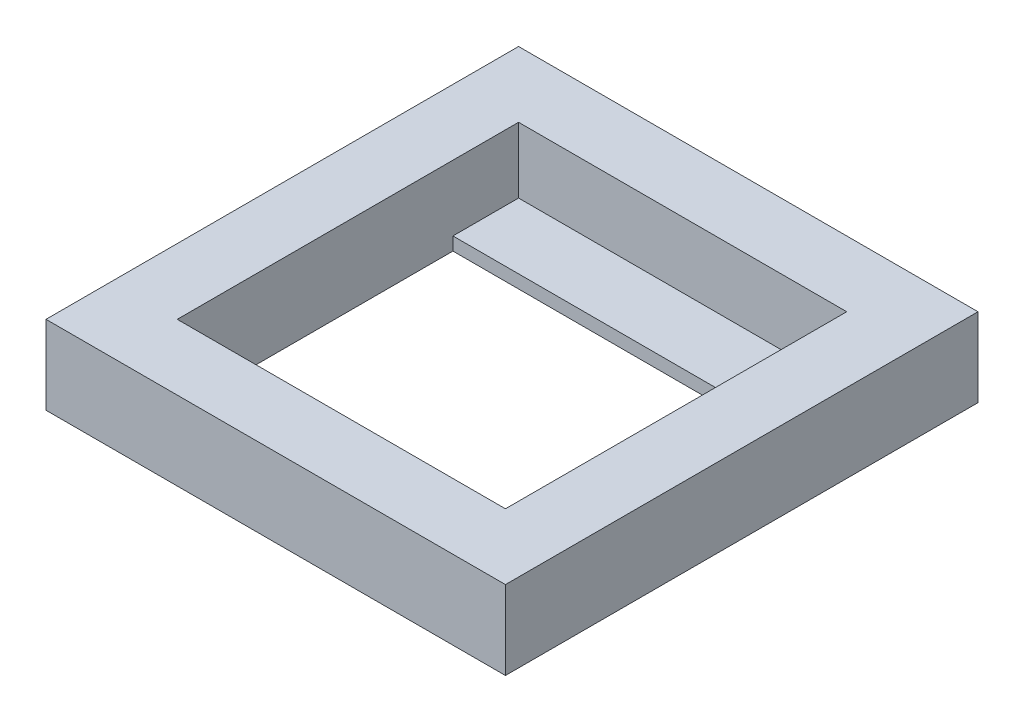
from build123d import *

# Parameters (mm, degrees)
SKETCH1_W           = 70
SKETCH1_H           = 72
BOSS_EXTRUDE1_DEPTH = 2
SKETCH2_W           = 50
SKETCH2_H           = 32
CUT_EXTRUDE1_DEPTH  = 12
SKETCH3_W           = 10
SKETCH3_H           = 52
SKETCH3_H_2         = 10
SKETCH3_W_2         = 50
BOSS_EXTRUDE2_DEPTH = 10


with BuildPart() as part:
    # Sketch1 → Boss-Extrude1 (new body)
    with BuildSketch(Plane(origin=(0, 0, 0), x_dir=(1, 0, 0), z_dir=(0, 1, 0))):
        with Locations((35, 36)):
            Rectangle(SKETCH1_W, SKETCH1_H)
    extrude(amount=BOSS_EXTRUDE1_DEPTH)

    # Sketch2 → Cut-Extrude1 (cut)
    with BuildSketch(Plane(origin=(0, 2, 0), x_dir=(1, 0, 0), z_dir=(0, 1, 0))):
        with Locations((35, 36)):
            Rectangle(SKETCH2_W, SKETCH2_H)
    extrude(amount=-CUT_EXTRUDE1_DEPTH, mode=Mode.SUBTRACT)

    # Sketch3 → Boss-Extrude2 (add)
    with BuildSketch(Plane(origin=(0, 2, 0), x_dir=(1, 0, 0), z_dir=(0, 1, 0))):
        with Locations((5, 36)):
            Rectangle(SKETCH3_W, SKETCH3_H)
        with Locations((5, 67)):
            Rectangle(SKETCH3_W, SKETCH3_H_2)
        with Locations((35, 67)):
            Rectangle(SKETCH3_W_2, SKETCH3_H_2)
        with Locations((5, 5)):
            Rectangle(SKETCH3_W, SKETCH3_H_2)
        with Locations((35, 5)):
            Rectangle(SKETCH3_W_2, SKETCH3_H_2)
        with Locations((65, 5)):
            Rectangle(SKETCH3_W, SKETCH3_H_2)
        with Locations((65, 36)):
            Rectangle(SKETCH3_W, SKETCH3_H)
        with Locations((65, 67)):
            Rectangle(SKETCH3_W, SKETCH3_H_2)
    extrude(amount=BOSS_EXTRUDE2_DEPTH)


solid = part.part
